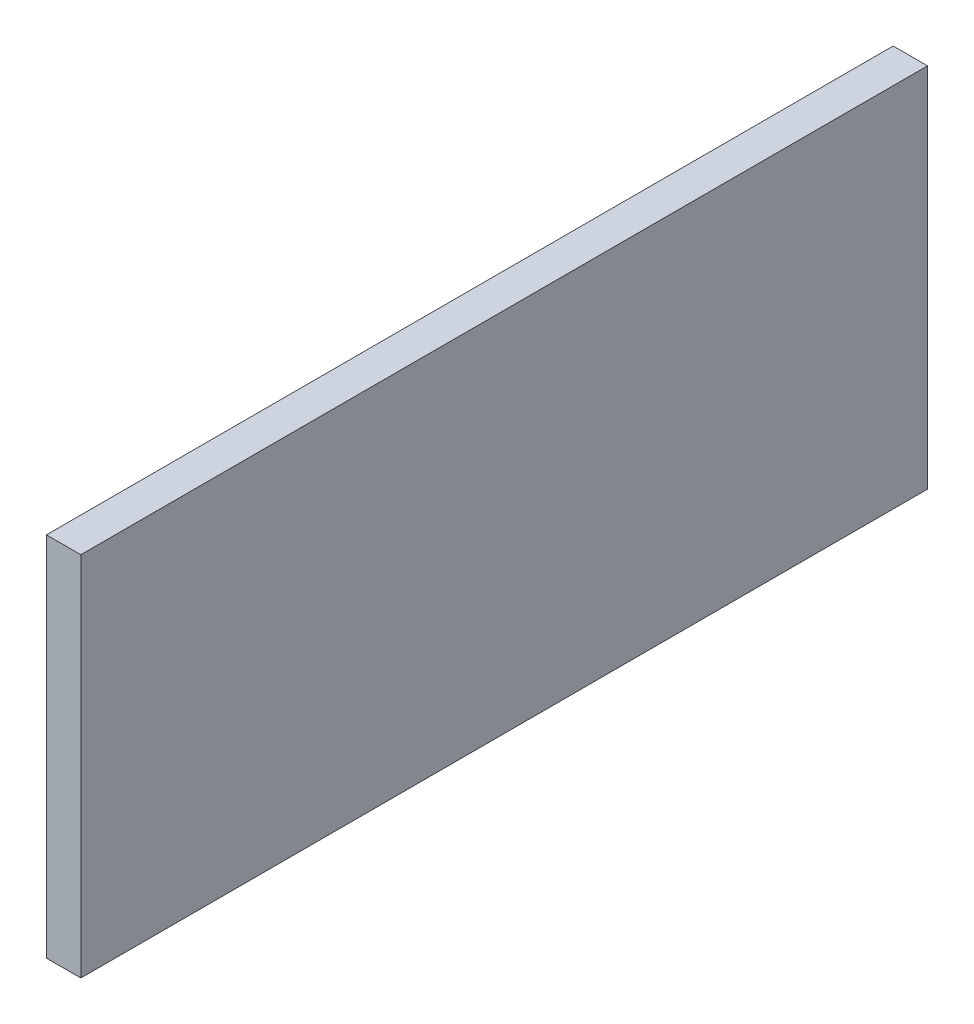
from build123d import *

# Parameters (mm, degrees)
SKETCH2_W           = 117.348
SKETCH2_H           = 50.8
BOSS_EXTRUDE1_DEPTH = 4.7625


with BuildPart() as part:
    # Sketch2 → Boss-Extrude1 (new body)
    with BuildSketch(Plane(origin=(0, 0, 0), x_dir=(0, 0, -1), z_dir=(1, 0, 0))):
        with Locations((58.674, 25.4)):
            Rectangle(SKETCH2_W, SKETCH2_H)
    extrude(amount=BOSS_EXTRUDE1_DEPTH)


solid = part.part
